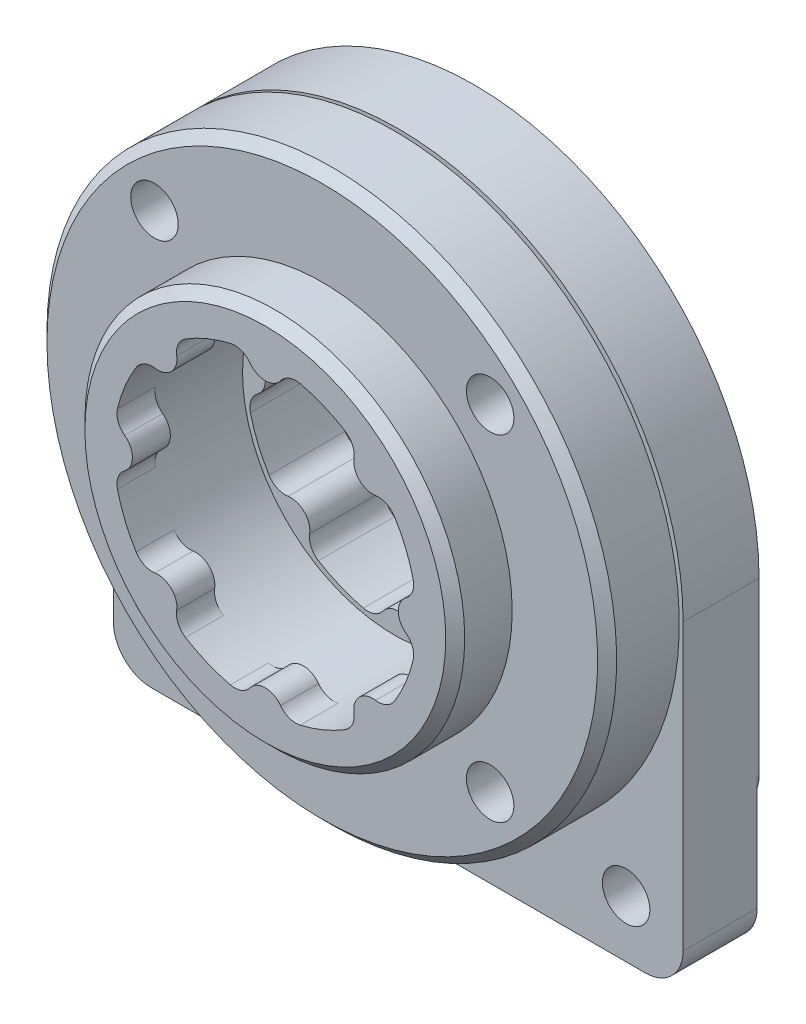
from build123d import *

# Parameters (mm, degrees)
SKETCH_1_R          = 10
SKETCH_1_R_2        = 7
EXTRUDE_1_DEPTH     = 2
EXTRUDE_START       = 5
SKETCH_2_R          = 10
SKETCH_2_R_2        = 8
EXTRUDE_2_DEPTH     = 5
CUT_EXTRUDE_START   = -2
CUT_EXTRUDE_2_DEPTH = 2
FILLET_4_R          = 1
SKETCH_4_R          = 15
SKETCH_4_R_2        = 10
SKETCH_4_R_3        = 1.25
EXTRUDE_3_DEPTH     = 4
SKETCH_5_R          = 1.5
EXTRUDE_4_DEPTH     = 4
FILLET_5_R          = 1
SKETCH_6_R          = 15
CUT_EXTRUDE_3_DEPTH = 0.2
SKETCH_7_W          = 30
SKETCH_7_H          = 6
CUT_EXTRUDE_4_DEPTH = 0.1
FILLET_6_R          = 2
SKETCH_8_R          = 1.25
CUT_EXTRUDE_5_DEPTH = 11
CHAMFER_1_SIZE      = 0.5


with BuildPart() as part:
    # 草图1 → 凸台-拉伸1 (new body)
    with BuildSketch(Plane.XY):
        Circle(SKETCH_1_R)
        Circle(SKETCH_1_R_2, mode=Mode.SUBTRACT)
    extrude(amount=EXTRUDE_1_DEPTH)

    # 草图2 → 凸台-拉伸2 (add)
    with BuildSketch(Plane(origin=(0, 0, 0), x_dir=(-1, 0, 0), z_dir=(0, 0, -1)).offset(EXTRUDE_START)):
        Circle(SKETCH_2_R)
        Circle(SKETCH_2_R_2, mode=Mode.SUBTRACT)
    extrude(amount=-EXTRUDE_2_DEPTH)

    # 草图3 → 切除-拉伸2 (cut)
    with BuildSketch(Plane.XY.offset(2).offset(CUT_EXTRUDE_START)):
        with BuildLine():
            ThreePointArc((7, 0), (7.271131013, 0.684653197), (7.9375, 0.998044964))
            ThreePointArc((7.9375, 0.998044964), (7.39103626, 3.061467459), (6.318384438, 4.906935714))
            ThreePointArc((6.318384438, 4.906935714), (5.625588965, 4.657343128), (4.949747468, 4.949747468))
            ThreePointArc((4.949747468, 4.949747468), (6.467156728, 2.678784027), (7, 0))
        make_face()
        with BuildLine():
            ThreePointArc((6.318384438, -4.906935714), (7.39103626, -3.061467459), (7.9375, -0.998044964))
            ThreePointArc((7.9375, -0.998044964), (7.271131013, -0.684653197), (7, 0))
            ThreePointArc((7, 0), (6.467156729, -2.678784024), (4.949747472, -4.949747465))
            ThreePointArc((4.949747472, -4.949747465), (5.625588967, -4.657343128), (6.318384438, -4.906935714))
        make_face()
        with BuildLine():
            ThreePointArc((4.949747468, 4.949747468), (4.657343128, 5.625588965), (4.906935714, 6.318384438))
            ThreePointArc((4.906935714, 6.318384438), (3.061467459, 7.39103626), (0.998044964, 7.9375))
            ThreePointArc((0.998044964, 7.9375), (0.684653197, 7.271131013), (0, 7))
            ThreePointArc((0, 7), (2.678784027, 6.467156728), (4.949747468, 4.949747468))
        make_face()
        with BuildLine():
            ThreePointArc((4.906935714, -6.318384438), (4.657343128, -5.625588962), (4.949747472, -4.949747465))
            ThreePointArc((4.949747472, -4.949747465), (2.678784028, -6.467156727), (-2e-09, -7))
            ThreePointArc((-2e-09, -7), (0.684653196, -7.271131012), (0.998044964, -7.9375))
            ThreePointArc((0.998044964, -7.9375), (3.061467459, -7.39103626), (4.906935714, -6.318384438))
        make_face()
        with BuildLine():
            ThreePointArc((-4.949747468, 4.949747468), (-2.678784027, 6.467156728), (0, 7))
            ThreePointArc((0, 7), (-0.684653197, 7.271131013), (-0.998044964, 7.9375))
            ThreePointArc((-0.998044964, 7.9375), (-3.061467459, 7.39103626), (-4.906935714, 6.318384438))
            ThreePointArc((-4.906935714, 6.318384438), (-4.657343128, 5.625588965), (-4.949747468, 4.949747468))
        make_face()
        with BuildLine():
            ThreePointArc((-0.998044964, -7.9375), (-0.684653198, -7.271131014), (-2e-09, -7))
            ThreePointArc((-2e-09, -7), (-2.678784022, -6.46715673), (-4.949747459, -4.949747477))
            ThreePointArc((-4.949747459, -4.949747477), (-4.657343128, -5.625588971), (-4.906935714, -6.318384438))
            ThreePointArc((-4.906935714, -6.318384438), (-3.061467459, -7.39103626), (-0.998044964, -7.9375))
        make_face()
        with BuildLine():
            ThreePointArc((-7, 0), (-6.467156728, 2.678784027), (-4.949747468, 4.949747468))
            ThreePointArc((-4.949747468, 4.949747468), (-5.625588965, 4.657343128), (-6.318384438, 4.906935714))
            ThreePointArc((-6.318384438, 4.906935714), (-7.39103626, 3.061467459), (-7.9375, 0.998044964))
            ThreePointArc((-7.9375, 0.998044964), (-7.271131013, 0.684653197), (-7, 0))
        make_face()
        with BuildLine():
            ThreePointArc((-6.318384438, -4.906935714), (-5.625588958, -4.657343128), (-4.949747459, -4.949747477))
            ThreePointArc((-4.949747459, -4.949747477), (-6.467156725, -2.678784032), (-7, 0))
            ThreePointArc((-7, 0), (-7.271131013, -0.684653197), (-7.9375, -0.998044964))
            ThreePointArc((-7.9375, -0.998044964), (-7.39103626, -3.061467459), (-6.318384438, -4.906935714))
        make_face()
    extrude(amount=CUT_EXTRUDE_2_DEPTH, mode=Mode.SUBTRACT)

    # 圆角4
    fillet_4_edges = [part.edges().sort_by_distance(p)[0] for p in [
        (6.318384438, -4.906935714, 1),
        (7.9375, -0.998044964, 1),
        (4.906935714, 6.318384438, 1),
        (0.998044964, 7.9375, 1),
        (7.9375, 0.998044964, 1),
        (6.318384438, 4.906935714, 1),
        (-4.906935714, 6.318384438, 1),
        (-0.998044964, 7.9375, 1),
        (-7.9375, -0.998044964, 1),
        (-6.318384438, -4.906935714, 1),
        (0.998044964, -7.9375, 1),
        (4.906935714, -6.318384438, 1),
        (-6.318384438, 4.906935714, 1),
        (-7.9375, 0.998044964, 1),
        (-4.906935714, -6.318384438, 1),
        (-0.998044964, -7.9375, 1),
    ]]
    fillet(fillet_4_edges, radius=FILLET_4_R)

    # 草图4 → 凸台-拉伸3 (add)
    with BuildSketch(Plane(origin=(0, 0, -5), x_dir=(-1, 0, 0), z_dir=(0, 0, -1))):
        Circle(SKETCH_4_R)
        Circle(SKETCH_4_R_2, mode=Mode.SUBTRACT)
        with Locations((8.838834765, 8.838834765)):
            Circle(SKETCH_4_R_3, mode=Mode.SUBTRACT)
        with Locations((8.838834765, -8.838834765)):
            Circle(SKETCH_4_R_3, mode=Mode.SUBTRACT)
        with Locations((-8.838834765, -8.838834765)):
            Circle(SKETCH_4_R_3, mode=Mode.SUBTRACT)
        with Locations((-8.838834765, 8.838834765)):
            Circle(SKETCH_4_R_3, mode=Mode.SUBTRACT)
    extrude(amount=-EXTRUDE_3_DEPTH)

    # 草图6 → 切除-拉伸3 (cut)
    with BuildSketch(Plane(origin=(0, 0, -5), x_dir=(-1, 0, 0), z_dir=(0, 0, -1))):
        Circle(SKETCH_6_R)
    extrude(amount=-CUT_EXTRUDE_3_DEPTH, mode=Mode.SUBTRACT)

    # 倒角1
    chamfer_1_edges = [part.edges().sort_by_distance(p)[0] for p in [
        (15, 0, -1),
        (-10, 0, 2),
    ]]
    chamfer(chamfer_1_edges, length=CHAMFER_1_SIZE)


with BuildPart() as body_2:
    # 草图5 → 凸台-拉伸4 (new body)
    with BuildSketch(Plane(origin=(0, 0, -5), x_dir=(-1, 0, 0), z_dir=(0, 0, -1))):
        with BuildLine():
            Line((15, -17), (15, 0))
            ThreePointArc((15, 0), (0, 15), (-15, 0))
            Line((-15, 0), (-15, -17))
            Line((-15, -17), (15, -17))
        make_face()
        with Locations((8.838834765, 8.838834765)):
            Circle(SKETCH_5_R, mode=Mode.SUBTRACT)
        with Locations((-8.838834765, -8.838834765)):
            Circle(SKETCH_5_R, mode=Mode.SUBTRACT)
        with Locations((8.838834765, -8.838834765)):
            Circle(SKETCH_5_R, mode=Mode.SUBTRACT)
        with Locations((-8.838834765, 8.838834765)):
            Circle(SKETCH_5_R, mode=Mode.SUBTRACT)
        with BuildLine():
            ThreePointArc((6.318384438, 4.906935714), (7.39103626, 3.061467459), (7.9375, 0.998044964))
            ThreePointArc((7.9375, 0.998044964), (7, 0), (7.9375, -0.998044964))
            ThreePointArc((7.9375, -0.998044964), (7.39103626, -3.061467459), (6.318384438, -4.906935714))
            ThreePointArc((6.318384438, -4.906935714), (4.949747468, -4.949747468), (4.906935714, -6.318384438))
            ThreePointArc((4.906935714, -6.318384438), (3.061467459, -7.39103626), (0.998044964, -7.9375))
            ThreePointArc((0.998044964, -7.9375), (0, -7), (-0.998044964, -7.9375))
            ThreePointArc((-0.998044964, -7.9375), (-3.061467459, -7.39103626), (-4.906935714, -6.318384438))
            ThreePointArc((-4.906935714, -6.318384438), (-4.949747468, -4.949747468), (-6.318384438, -4.906935714))
            ThreePointArc((-6.318384438, -4.906935714), (-7.39103626, -3.061467459), (-7.9375, -0.998044964))
            ThreePointArc((-7.9375, -0.998044964), (-7, 0), (-7.9375, 0.998044964))
            ThreePointArc((-7.9375, 0.998044964), (-7.39103626, 3.061467459), (-6.318384438, 4.906935714))
            ThreePointArc((-6.318384438, 4.906935714), (-4.949747468, 4.949747468), (-4.906935714, 6.318384438))
            ThreePointArc((-4.906935714, 6.318384438), (-3.061467459, 7.39103626), (-0.998044964, 7.9375))
            ThreePointArc((-0.998044964, 7.9375), (0, 7), (0.998044964, 7.9375))
            ThreePointArc((0.998044964, 7.9375), (3.061467459, 7.39103626), (4.906935714, 6.318384438))
            ThreePointArc((4.906935714, 6.318384438), (4.949747468, 4.949747468), (6.318384438, 4.906935714))
        make_face(mode=Mode.SUBTRACT)
    extrude(amount=EXTRUDE_4_DEPTH)

    # 圆角5
    fillet_5_edges = [body_2.edges().sort_by_distance(p)[0] for p in [
        (7.9375, 0.998044964, -7),
        (7.9375, -0.998044964, -7),
        (6.318384438, -4.906935714, -7),
        (4.906935714, -6.318384438, -7),
        (0.998044964, -7.9375, -7),
        (-0.998044964, -7.9375, -7),
        (-4.906935714, -6.318384438, -7),
        (-6.318384438, -4.906935714, -7),
        (-7.9375, -0.998044964, -7),
        (-7.9375, 0.998044964, -7),
        (-6.318384438, 4.906935714, -7),
        (-4.906935714, 6.318384438, -7),
        (-0.998044964, 7.9375, -7),
        (0.998044964, 7.9375, -7),
        (4.906935714, 6.318384438, -7),
        (6.318384438, 4.906935714, -7),
    ]]
    fillet(fillet_5_edges, radius=FILLET_5_R)

    # 草图7 → 切除-拉伸4 (cut)
    with BuildSketch(Plane(origin=(0, 0, -9), x_dir=(-1, 0, 0), z_dir=(0, 0, -1))):
        with Locations((0, -14)):
            Rectangle(SKETCH_7_W, SKETCH_7_H)
    extrude(amount=-CUT_EXTRUDE_4_DEPTH, mode=Mode.SUBTRACT)

    # 圆角6
    fillet_6_edges = [body_2.edges().sort_by_distance(p)[0] for p in [
        (-15, -17, -6.95),
        (15, -17, -6.95),
        (15, -11, -8.95),
        (-15, -11, -8.95),
    ]]
    fillet(fillet_6_edges, radius=FILLET_6_R)

    # 草图8 → 切除-拉伸5 (cut)
    with BuildSketch(Plane(origin=(0, 0, -8.9), x_dir=(-1, 0, 0), z_dir=(0, 0, -1))):
        with Locations((12, -14)):
            Circle(SKETCH_8_R)
        with Locations((-12, -14)):
            Circle(SKETCH_8_R)
    extrude(amount=-CUT_EXTRUDE_5_DEPTH, mode=Mode.SUBTRACT)


solid = Compound([part.part, body_2.part])
